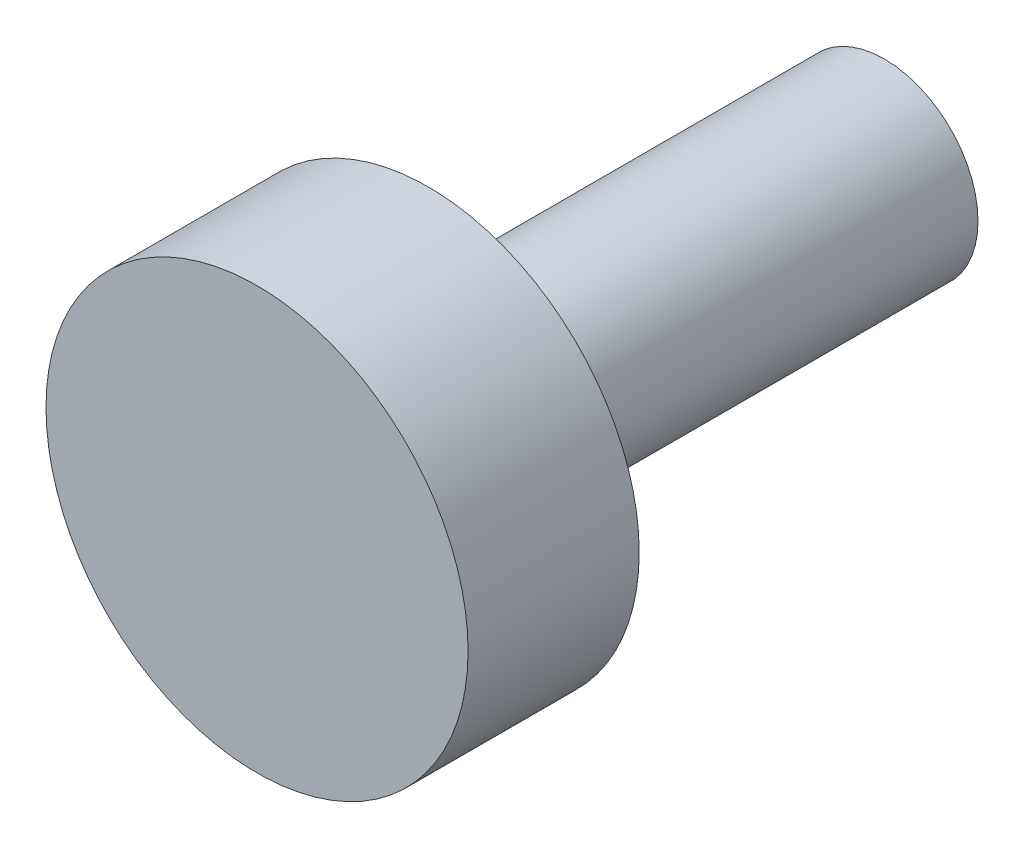
from build123d import *

# Parameters (mm, degrees)
THREAD_ENVELOPE_START = 1
PROFILE_1_R           = 1.64
THREAD_ENVELOPE_DEPTH = 8
SCREW_HEAD_START      = 9
PROFILE_2_R           = 3.7
SCREW_HEAD_DEPTH      = 3


with BuildPart() as part:
    # Profile_1 → Thread_envelope (new body)
    with BuildSketch(Plane.XY.offset(THREAD_ENVELOPE_START)):
        Circle(PROFILE_1_R)
    extrude(amount=THREAD_ENVELOPE_DEPTH)

    # Profile_2 → Screw_head (add)
    with BuildSketch(Plane.XY.offset(SCREW_HEAD_START)):
        Circle(PROFILE_2_R)
    extrude(amount=SCREW_HEAD_DEPTH)


solid = part.part
